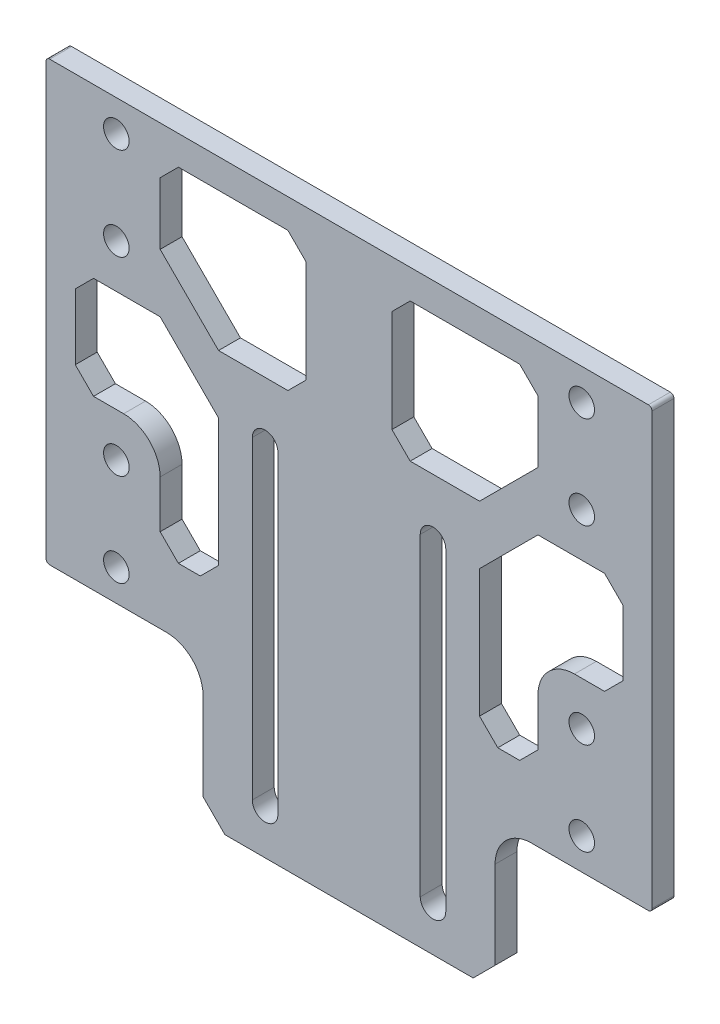
from build123d import *

# Parameters (mm, degrees)
ESBO_O1_W                = 166
ESBO_O1_H                = 120
RESSALTO_EXTRUS_O1_DEPTH = 6
ESBO_O2_R                = 3.5
CORTE_EXTRUS_O1_DEPTH    = 103.591422643
ESBO_O3_W                = 80
ESBO_O3_H                = 80
RESSALTO_EXTRUS_O2_DEPTH = 6
FILETE1_R                = 10
CHANFRO1_SIZE            = 6
CORTE_EXTRUS_O2_DEPTH    = 10
CORTE_EXTRUS_O3_DEPTH    = 131.096118313
RESSALTO_EXTRUS_O3_DEPTH = 6
FILETE2_R                = 10
CHANFRO2_SIZE            = 5
FILETE3_R                = 1


with BuildPart() as part:
    # Esboço1 → Ressalto-extrusão1 (new body)
    with BuildSketch(Plane.XY):
        Rectangle(ESBO_O1_W, ESBO_O1_H)
    extrude(amount=RESSALTO_EXTRUS_O1_DEPTH)

    # Esboço2 → Corte-extrusão1 (cut, through all)
    with BuildSketch(Plane.XY.offset(6)):
        with Locations((-63.75, -51.4)):
            Circle(ESBO_O2_R)
        with Locations((-63.75, -26)):
            Circle(ESBO_O2_R)
        with Locations((-63.75, 26)):
            Circle(ESBO_O2_R)
        with Locations((-63.75, 51.4)):
            Circle(ESBO_O2_R)
        with Locations((63.75, -51.4)):
            Circle(ESBO_O2_R)
        with Locations((63.75, -26)):
            Circle(ESBO_O2_R)
        with Locations((63.75, 26)):
            Circle(ESBO_O2_R)
        with Locations((63.75, 51.4)):
            Circle(ESBO_O2_R)
    extrude(amount=-CORTE_EXTRUS_O1_DEPTH, mode=Mode.SUBTRACT)

    # Esboço3 → Ressalto-extrusão2 (add, through all)
    with BuildSketch(Plane.XY.offset(6)):
        with Locations((0, -60)):
            Rectangle(ESBO_O3_W, ESBO_O3_H)
    extrude(amount=-RESSALTO_EXTRUS_O2_DEPTH)

    # Filete1
    filete1_edges = [part.edges().sort_by_distance(p)[0] for p in [
        (40, -60, 3),
        (-40, -60, 3),
    ]]
    fillet(filete1_edges, radius=FILETE1_R)

    # Chanfro1
    chanfro1_edges = [part.edges().sort_by_distance(p)[0] for p in [
        (-40, -100, 3),
        (40, -100, 3),
    ]]
    chamfer(chanfro1_edges, length=CHANFRO1_SIZE)

    # Esboço4 → Corte-extrusão2 (cut)
    with BuildSketch(Plane.XY.offset(6)):
        with BuildLine():
            Line((-19.5, -2), (-19.5, -88))
            ThreePointArc((-19.5, -88), (-23, -91.5), (-26.5, -88))
            Line((-26.5, -88), (-26.5, -2))
            ThreePointArc((-26.5, -2), (-23, 1.5), (-19.5, -2))
        make_face()
        with BuildLine():
            Line((26.5, -2), (26.5, -88))
            ThreePointArc((26.5, -88), (23, -91.5), (19.5, -88))
            Line((19.5, -88), (19.5, -2))
            ThreePointArc((19.5, -2), (23, 1.5), (26.5, -2))
        make_face()
    extrude(amount=-CORTE_EXTRUS_O2_DEPTH, mode=Mode.SUBTRACT)

    # Esboço5 → Corte-extrusão3 (cut, through all)
    with BuildSketch(Plane.XY.offset(6)):
        Polygon((-51.75, 52), (-51.75, 14), (-75, 14), (-75, -14), (-51.75, -14), (-51.75, -42), (-35.75, -42), (-35.75, 14), (-11.75, 14), (-11.75, 52), align=None)
        Polygon((75, -14), (51.75, -14), (51.75, -42), (35.75, -42), (35.75, 14), (11.75, 14), (11.75, 52), (51.75, 52), (51.75, 14), (75, 14), align=None)
    extrude(amount=-CORTE_EXTRUS_O3_DEPTH, mode=Mode.SUBTRACT)

    # Esboço6 → Ressalto-extrusão3 (add, through all)
    with BuildSketch(Plane.XY.offset(6)):
        Polygon((-51.75, 14), (-35.75, -2), (-35.75, 14), (-51.75, 30), align=None)
        Polygon((35.75, 14), (51.75, 30), (51.75, 14), (35.75, -2), align=None)
    extrude(amount=-RESSALTO_EXTRUS_O3_DEPTH)

    # Filete2
    filete2_edges = [part.edges().sort_by_distance(p)[0] for p in [
        (-51.75, -14, 3),
        (51.75, -14, 3),
    ]]
    fillet(filete2_edges, radius=FILETE2_R)

    # Chanfro2
    chanfro2_edges = [part.edges().sort_by_distance(p)[0] for p in [
        (-51.75, 52, 3),
        (-11.75, 52, 3),
        (-11.75, 14, 3),
        (-35.75, -42, 3),
        (-51.75, -42, 3),
        (-75, -14, 3),
        (-75, 14, 3),
        (75, 14, 3),
        (75, -14, 3),
        (51.75, -42, 3),
        (35.75, -42, 3),
        (11.75, 14, 3),
        (11.75, 52, 3),
        (51.75, 52, 3),
    ]]
    chamfer(chanfro2_edges, length=CHANFRO2_SIZE)

    # Filete3
    filete3_edges = [part.edges().sort_by_distance(p)[0] for p in [
        (83, -60, 3),
        (-83, -60, 3),
        (-83, 60, 3),
        (83, 60, 3),
    ]]
    fillet(filete3_edges, radius=FILETE3_R)


solid = part.part
